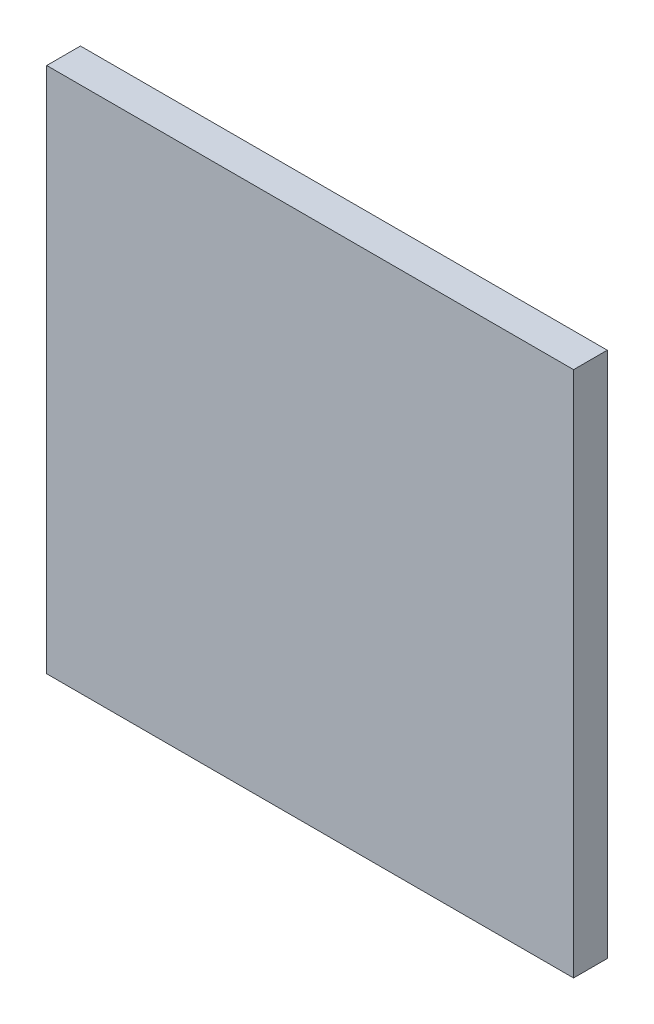
from build123d import *

# Parameters (mm, degrees)
SKETCH1_W           = 12.5
SKETCH1_H           = 12.5
BOSS_EXTRUDE1_DEPTH = 0.8


with BuildPart() as part:
    # Sketch1 → Boss-Extrude1 (new body)
    with BuildSketch(Plane.XY):
        with Locations((6.25, 6.25)):
            Rectangle(SKETCH1_W, SKETCH1_H)
    extrude(amount=BOSS_EXTRUDE1_DEPTH)


solid = part.part
